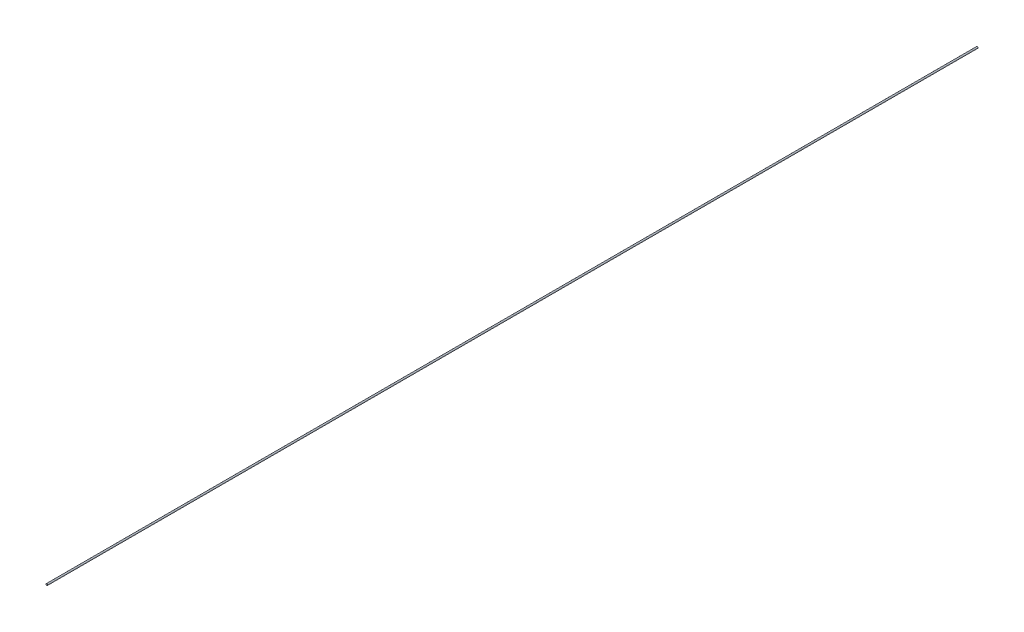
from build123d import *

# Parameters (mm, degrees)
SKETCH1_R           = 0.33
BOSS_EXTRUDE1_DEPTH = 400


with BuildPart() as part:
    # Sketch1 → Boss-Extrude1 (new body)
    with BuildSketch(Plane.XY):
        Circle(SKETCH1_R)
    extrude(amount=BOSS_EXTRUDE1_DEPTH)


solid = part.part
